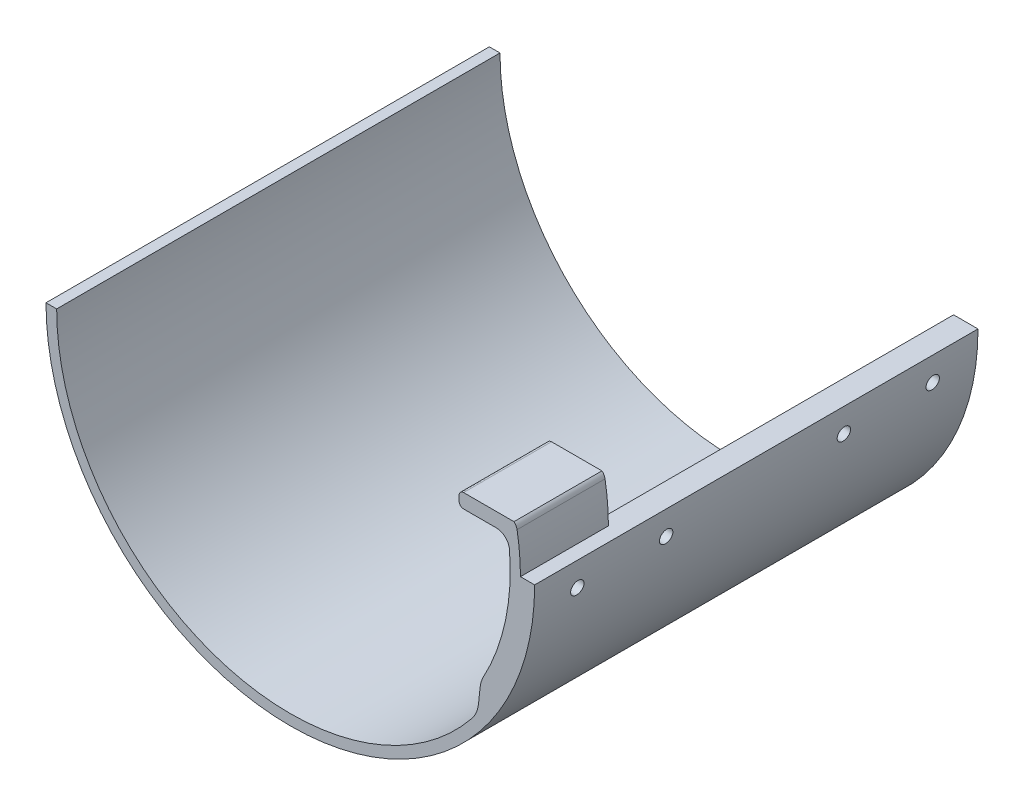
from build123d import *

# Parameters (mm, degrees)
EXTRUDE_1_DEPTH     = 99.8
SKETCH_7_R          = 1.5
CUT_EXTRUDE_6_DEPTH = 80
CUT_EXTRUDE_7_DEPTH = 80


with BuildPart() as part:
    # 草图1 → 凸台-拉伸1 (new body)
    with BuildSketch(Plane.XY):
        with BuildLine():
            Line((-55, 0), (-52.6, 0))
            ThreePointArc((-52.6, 0), (-17.5838694, -49.573859411), (40.843632582, -33.144496941))
            ThreePointArc((40.843632582, -33.144496941), (41.8776275, -31.406850611), (42.371810697, -29.446150933))
            Line((42.371810697, -29.446150933), (42.701389329, -26.225087281))
            ThreePointArc((42.701389329, -26.225087281), (42.976584625, -24.872497257), (43.511842068, -23.600203386))
            ThreePointArc((43.511842068, -23.600203386), (48.437324754, -10.201743511), (49.33443696, 4.04516129))
            ThreePointArc((49.33443696, 4.04516129), (48.377266711, 6.006295976), (46.344471083, 6.8))
            Line((46.344471083, 6.8), (39, 6.8))
            ThreePointArc((39, 6.8), (38.292893219, 7.092893219), (38, 7.8))
            Line((38, 7.8), (38, 9))
            ThreePointArc((38, 9), (38.292893219, 9.707106781), (39, 10))
            Line((39, 10), (50.344019583, 10))
            ThreePointArc((50.344019583, 10), (50.805346897, 9.459374484), (51.0484918, 8.791557597))
            ThreePointArc((51.0484918, 8.791557597), (51.611780996, 4.411809423), (51.8, 0))
            Line((51.8, 0), (55, 0))
            ThreePointArc((55, 0), (0, -55), (-55, 0))
        make_face()
    extrude(amount=EXTRUDE_1_DEPTH)

    # 草图7 → 切除-拉伸6 (cut)
    with BuildSketch(Plane(origin=(0, 0, 0), x_dir=(0.10066073352284005, 0.994920809274107, 0), z_dir=(-0.9949208092741069, 0.10066073352284004, 0))):
        with Locations(Location((-0.136340344, -9.9, 0), (0, 0, 180))):
            Circle(SKETCH_7_R)
        with Locations(Location((-0.136340344, -29.9, 0), (0, 0, 180))):
            Circle(SKETCH_7_R)
        with Locations(Location((-0.136340344, -69.9, 0), (0, 0, 180))):
            Circle(SKETCH_7_R)
        with Locations(Location((-0.136340344, -89.9, 0), (0, 0, 180))):
            Circle(SKETCH_7_R)
    extrude(amount=-CUT_EXTRUDE_6_DEPTH, mode=Mode.SUBTRACT)

    # 草图8 → 切除-拉伸7 (cut)
    with BuildSketch(Plane(origin=(0, 0, 0), x_dir=(-1, 0, 0), z_dir=(0, 0, -1))):
        with BuildLine():
            Line((-50.016978469, 22.875792113), (0, 0))
            Line((0, 0), (-55, 0))
            ThreePointArc((-55, 0), (-53.739807479, 11.70611345), (-50.016978469, 22.875792113))
        make_face()
    extrude(amount=-CUT_EXTRUDE_7_DEPTH, mode=Mode.SUBTRACT)


solid = part.part
